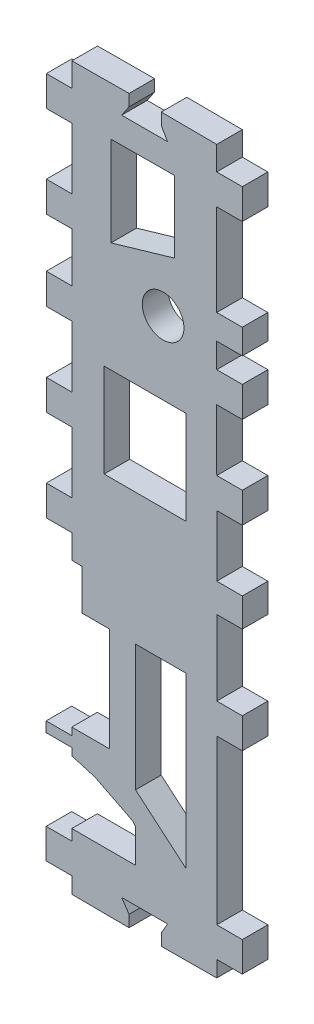
from build123d import *

# Parameters (mm, degrees)
SKETCH_4_R      = 8.137661996
SKETCH_4_W      = 31.9414987
SKETCH_4_H      = 36.578678147
EXTRUDE_1_DEPTH = 10


with BuildPart() as part:
    # 草图4 → 凸台-拉伸1 (new body)
    with BuildSketch(Plane.XY):
        Polygon((-115.679167542, 163.709819989), (-112.783171997, 167.977826386), (-112.783171997, 172.521825104), (-135.13516787, 172.401821332), (-135.13516787, 163.073818402), (-145.12317358, 163.073823243), (-145.12317358, 151.265824585), (-135.13516787, 151.265819745), (-135.13516787, 127.321818547), (-145.12317358, 127.321823388), (-145.12317358, 115.485822707), (-135.13517271, 115.485822707), (-135.13517271, 96.149821549), (-145.123168739, 96.149816708), (-145.123168739, 84.229816632), (-135.13516787, 84.229816632), (-135.13516787, 60.175815779), (-145.121572289, 60.175815779), (-145.121564659, 48.342350203), (-135.13516024, 48.342350203), (-135.135152611, 24.396549422), (-145.121564659, 24.396549422), (-145.12155703, 12.587940413), (-135.135152611, 12.587940413), (-135.135152611, 3.261310774), (-131.182853493, 3.139713484), (-131.182853493, -12.691325945), (-120.512386116, -12.691325945), (-120.512386116, -53.276546281), (-135.177665504, -53.276546281), (-135.177665504, -56.177557678), (-145.201591286, -56.177547258), (-145.201591286, -60.195171159), (-135.177670343, -60.195181579), (-135.177670343, -63.017477722), (-126.064049585, -65.69681427), (-111.259845528, -73.199390215), (-110.188045296, -74.539134782), (-110.18804911, -87.630618852), (-135.177657875, -87.630618852), (-135.177657875, -91.900821489), (-145.201591286, -91.900821489), (-145.201591286, -103.616760057), (-135.177657875, -103.616760057), (-135.177657875, -109.910648149), (-112.782481941, -110.032245439), (-112.782471521, -105.487982482), (-115.679146631, -101.218363494), (-97.719758046, -101.218377487), (-100.181937965, -105.487979692), (-100.181937965, -110.032241624), (-78.482952936, -109.910639495), (-78.482950005, -103.616755218), (-68.496559961, -103.616759033), (-68.496559961, -91.90081665), (-78.482960566, -91.90081665), (-78.482959541, -27.976309509), (-68.496556147, -27.976309509), (-68.496556147, -16.124869079), (-78.482955727, -16.124869079), (-78.48294619, 13.220635682), (-68.49654661, 13.220635682), (-68.496550425, 24.47091034), (-78.482954844, 24.47091034), (-78.482957634, 48.412209778), (-68.496554239, 48.412209778), (-68.496558054, 60.263650208), (-78.482957634, 60.263650208), (-78.495166571, 84.237820893), (-68.499169214, 84.237820893), (-68.499169214, 96.109822541), (-78.495171412, 96.109822541), (-78.495171412, 105.761817174), (-68.499164374, 105.761817174), (-68.499164374, 115.473818021), (-78.495171412, 115.473822861), (-78.495171412, 151.265819745), (-68.499164374, 151.265819745), (-68.499169214, 163.073823243), (-78.495166573, 163.073818402), (-78.495166573, 172.401821332), (-100.183171615, 172.521825104), (-100.183171615, 167.977826386), (-97.72316626, 163.709819989), align=None)
        with Locations((-99.461505196, 103.795957581)):
            Circle(SKETCH_4_R, mode=Mode.SUBTRACT)
        Polygon((-110.230805262, -12.691321106), (-90.593654427, -12.691325945), (-90.593668373, -78.776897231), (-110.230815681, -62.066013139), align=None, mode=Mode.SUBTRACT)
        with Locations((-106.564418137, 57.028483651)):
            Rectangle(SKETCH_4_W, SKETCH_4_H, mode=Mode.SUBTRACT)
        Polygon((-119.863172396, 153.513820843), (-94.943171363, 153.621818753), (-94.943166525, 125.645818429), (-119.863172396, 118.361822902), align=None, mode=Mode.SUBTRACT)
    extrude(amount=EXTRUDE_1_DEPTH)


solid = part.part
